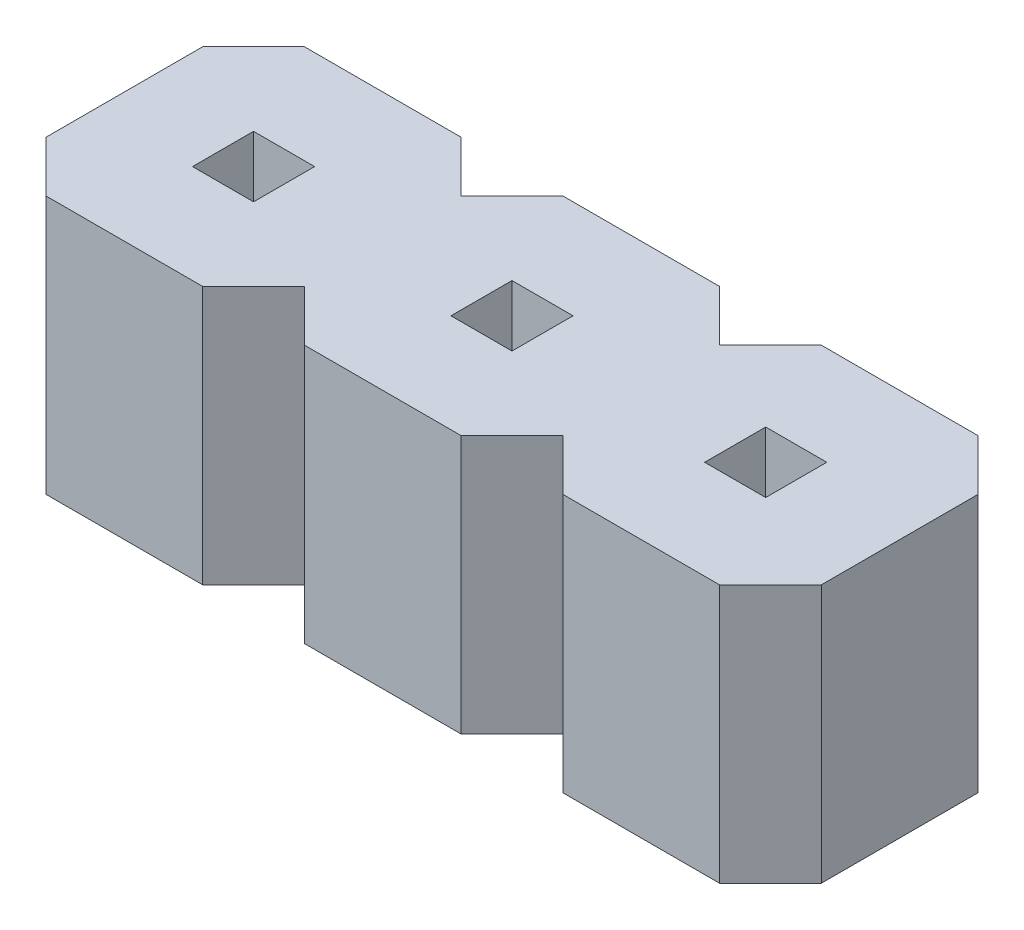
from build123d import *

# Parameters (mm, degrees)
SKETCH1_W           = 0.6
SKETCH1_H           = 0.6
BOSS_EXTRUDE1_DEPTH = 2.54


with BuildPart() as part:
    # Sketch1 → Boss-Extrude1 (new body)
    with BuildSketch(Plane(origin=(0, 0, 0), x_dir=(1, 0, 0), z_dir=(0, 1, 0))):
        Polygon((-0.5, 0), (-2.04, 0), (-2.54, 0.5), (-3.04, 0), (-4.58, 0), (-5.08, 0.5), (-5.08, 2.04), (-4.58, 2.54), (-3.04, 2.54), (-2.54, 2.04), (-2.04, 2.54), (-0.5, 2.54), (0, 2.04), (0.5, 2.54), (2.04, 2.54), (2.54, 2.04), (2.54, 0.5), (2.04, 0), (0.5, 0), (0, 0.5), align=None)
        with Locations((-3.81, 1.27)):
            Rectangle(SKETCH1_W, SKETCH1_H, mode=Mode.SUBTRACT)
        with Locations((-1.27, 1.27)):
            Rectangle(SKETCH1_W, SKETCH1_H, mode=Mode.SUBTRACT)
        with Locations((1.223573691, 1.27)):
            Rectangle(SKETCH1_W, SKETCH1_H, mode=Mode.SUBTRACT)
    extrude(amount=BOSS_EXTRUDE1_DEPTH)


solid = part.part
